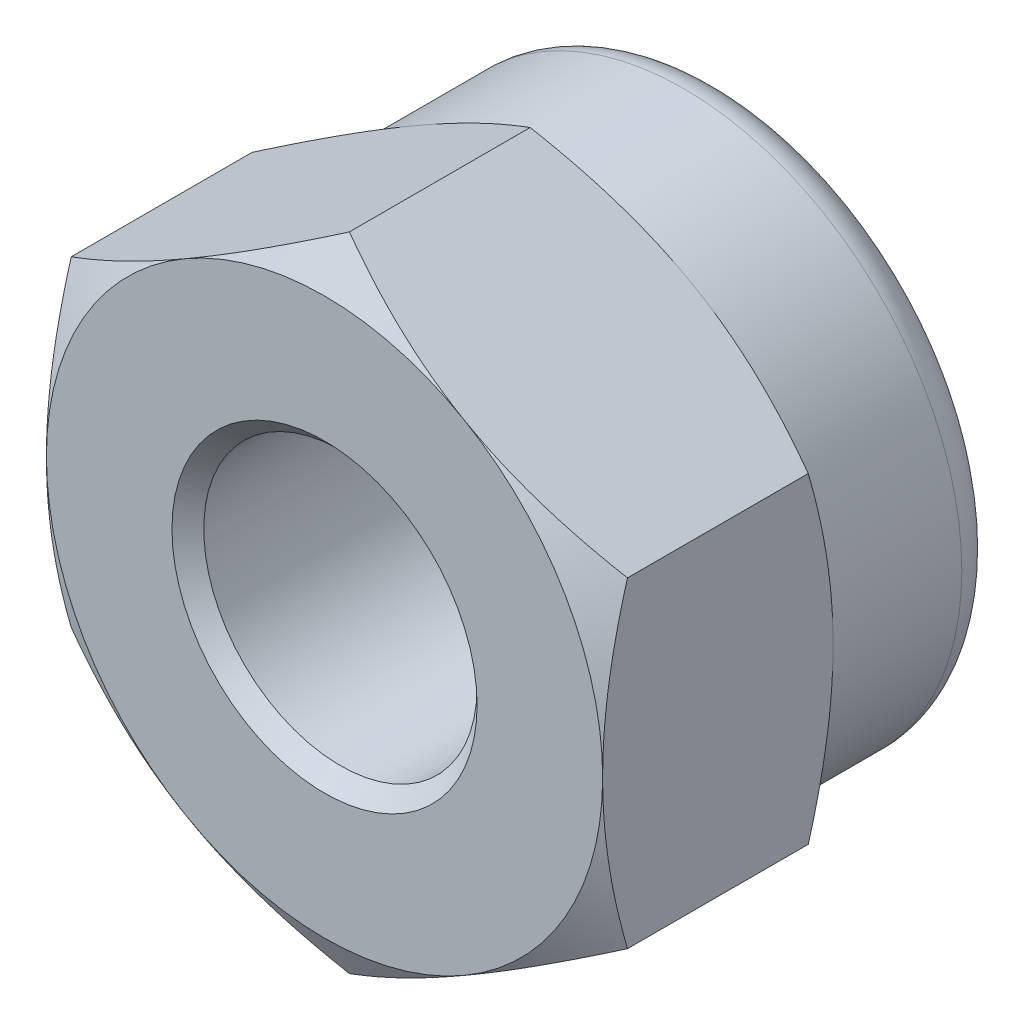
from build123d import *

# Parameters (mm, degrees)
SKETCH_1_R          = 1.72
EXTRUDE_1_DEPTH     = 2.9
SKETCH_5_R          = 3.5
SKETCH_5_R_2        = 2.2
EXTRUDE_4_DEPTH     = 2.1
FILLET_2_R          = 0.48
SKETCH_6_R          = 2.5
CUT_EXTRUDE_1_DEPTH = 0.525
CHAMFER_2_SIZE      = 0.2


with BuildPart() as part:
    # 草图1 → 凸台-拉伸1 (new body)
    with BuildSketch(Plane.XY):
        Polygon((0, 4.041451884), (-3.5, 2.020725942), (-3.5, -2.020725942), (0, -4.041451884), (3.5, -2.020725942), (3.5, 2.020725942), align=None)
        Circle(SKETCH_1_R, mode=Mode.SUBTRACT)
    extrude(amount=-EXTRUDE_1_DEPTH)

    # 草图2 → 切除-旋转1 (revolve, cut)
    with BuildSketch(Plane(origin=(0, 0, 0), x_dir=(0, 0, -1), z_dir=(1, 0, 0))):
        Polygon((0, 3.5), (0.312607391, 4.041451884), (0, 4.041451884), align=None)
        Polygon((2.9, 3.5), (2.587392609, 4.041451884), (2.9, 4.041451884), align=None)
    revolve(axis=Axis((0, 0, 0), (0, 0, -1)), mode=Mode.SUBTRACT)

    # 草图5 → 凸台-拉伸4 (add)
    with BuildSketch(Plane(origin=(0, 0, -2.9), x_dir=(-1, 0, 0), z_dir=(0, 0, -1))):
        Circle(SKETCH_5_R)
        Circle(SKETCH_5_R_2, mode=Mode.SUBTRACT)
    extrude(amount=EXTRUDE_4_DEPTH)

    # 圆角2
    fillet_2_edges = [part.edges().sort_by_distance(p)[0] for p in [
        (3.5, 0, -5),
    ]]
    fillet(fillet_2_edges, radius=FILLET_2_R)

    # 草图6 → 切除-拉伸1 (cut)
    with BuildSketch(Plane(origin=(0, 0, -5), x_dir=(-1, 0, 0), z_dir=(0, 0, -1))):
        Circle(SKETCH_6_R)
    extrude(amount=-CUT_EXTRUDE_1_DEPTH, mode=Mode.SUBTRACT)

    # 倒角2
    chamfer_2_edges = [part.edges().sort_by_distance(p)[0] for p in [
        (-1.72, 0, -2.9),
        (-1.72, 0, 0),
    ]]
    chamfer(chamfer_2_edges, length=CHAMFER_2_SIZE)


solid = part.part
